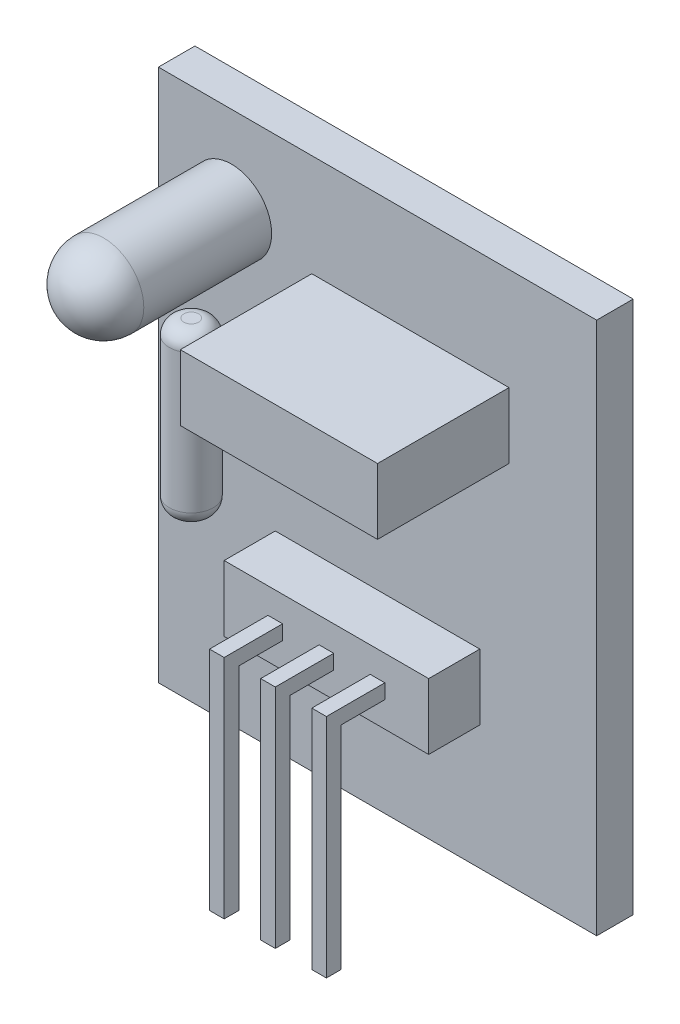
from build123d import *

# Parameters (mm, degrees)
SKETCH1_W           = 15.24
SKETCH1_H           = 18.542
BOSS_EXTRUDE1_DEPTH = 0.635
SKETCH2_W           = 7.112
SKETCH2_H           = 2.286
BOSS_EXTRUDE2_DEPTH = 1.778
SKETCH3_W           = 0.508
SKETCH3_H           = 0.508
BOSS_EXTRUDE3_DEPTH = 2.032
SKETCH4_W           = 0.508
SKETCH4_H           = 0.508
BOSS_EXTRUDE4_DEPTH = 7.366
SKETCH8_W           = 6.858
SKETCH8_H           = 2.286
BOSS_EXTRUDE6_DEPTH = 4.572
SKETCH9_R           = 1.397
BOSS_EXTRUDE7_DEPTH = 5.842
FILLET1_R           = 1.397
SKETCH10_R          = 0.762
BOSS_EXTRUDE8_DEPTH = 2.921
FILLET2_R           = 0.508


with BuildPart() as part:
    # Sketch1 → Boss-Extrude1 (new, symmetric)
    with BuildSketch(Plane.XY):
        Rectangle(SKETCH1_W, SKETCH1_H)
    extrude(amount=BOSS_EXTRUDE1_DEPTH, both=True)

    # Sketch2 → Boss-Extrude2 (add)
    with BuildSketch(Plane.XY.offset(0.635)):
        with Locations((0, -3.81)):
            Rectangle(SKETCH2_W, SKETCH2_H)
    extrude(amount=BOSS_EXTRUDE2_DEPTH)

    # Sketch3 → Boss-Extrude3 (add)
    with BuildSketch(Plane.XY.offset(2.413)):
        with Locations((-1.778, -3.81)):
            Rectangle(SKETCH3_W, SKETCH3_H)
        with Locations((0, -3.81)):
            Rectangle(SKETCH3_W, SKETCH3_H)
        with Locations((1.778, -3.81)):
            Rectangle(SKETCH3_W, SKETCH3_H)
    extrude(amount=BOSS_EXTRUDE3_DEPTH)

    # Sketch4 → Boss-Extrude4 (add)
    with BuildSketch(Plane.XZ.offset(4.064)):
        with Locations((-1.778, 4.191)):
            Rectangle(SKETCH4_W, SKETCH4_H)
        with Locations((0, 4.191)):
            Rectangle(SKETCH4_W, SKETCH4_H)
        with Locations((1.778, 4.191)):
            Rectangle(SKETCH4_W, SKETCH4_H)
    extrude(amount=BOSS_EXTRUDE4_DEPTH)

    # Sketch8 → Boss-Extrude6 (add)
    with BuildSketch(Plane.XY.offset(0.635)):
        with Locations((1.143, 4.572)):
            Rectangle(SKETCH8_W, SKETCH8_H)
    extrude(amount=BOSS_EXTRUDE6_DEPTH)

    # Sketch9 → Boss-Extrude7 (add)
    with BuildSketch(Plane.XY.offset(0.635)):
        with Locations((-5.08, 6.223)):
            Circle(SKETCH9_R)
    extrude(amount=BOSS_EXTRUDE7_DEPTH)

    # Fillet1
    fillet1_edges = [part.edges().sort_by_distance(p)[0] for p in [
        (-6.477, 6.223, 6.477),
    ]]
    fillet(fillet1_edges, radius=FILLET1_R)


with BuildPart() as body_2:
    # Sketch10 → Boss-Extrude8 (new, symmetric)
    with BuildSketch(Plane(origin=(0, 0, 0), x_dir=(1, 0, 0), z_dir=(0, 1, 0))):
        with Locations(Location((-5.842, -1.27, 0), (0, 0, 270))):
            Circle(SKETCH10_R)
    extrude(amount=BOSS_EXTRUDE8_DEPTH, both=True)

    # Fillet2
    fillet2_edges = [body_2.edges().sort_by_distance(p)[0] for p in [
        (-5.842, -2.921, 0.508),
        (-5.842, 2.921, 0.508),
    ]]
    fillet(fillet2_edges, radius=FILLET2_R)


solid = Compound([part.part, body_2.part])
